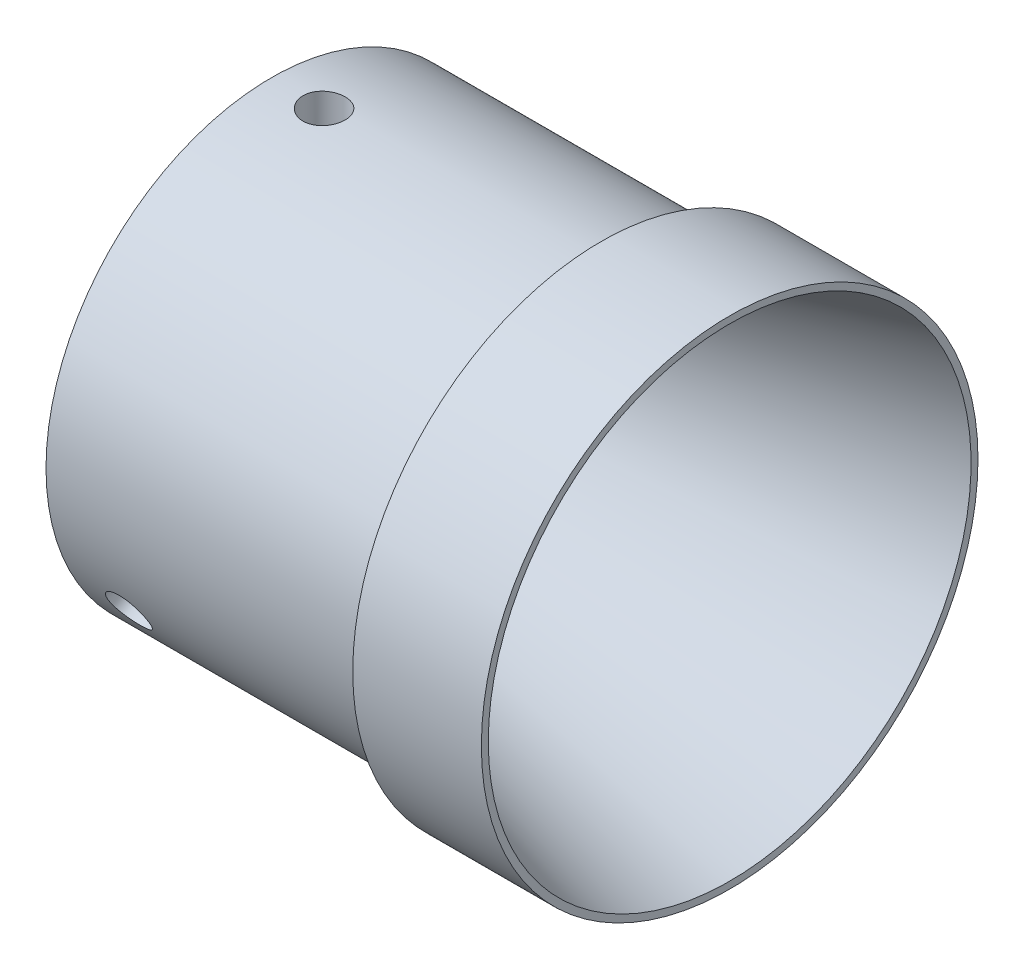
from build123d import *

# Parameters (mm, degrees)
CIRPATTERN1_COUNT = 3


with BuildPart() as part:
    # Sketch1 → Revolve1 (revolve)
    with BuildSketch(Plane.XY, mode=Mode.PRIVATE) as revolve1_sk:
        Polygon((0, 14.478), (21.149404438, 14.478), (21.149404438, 15.9385), (29.404404438, 15.9385), (29.404404438, 15.494), (3.81, 8.636), (3.81, 10.16), (0, 10.16), align=None)
    revolve(revolve1_sk.sketch.rotate(Axis((0, 0, 0), (1, 0, 0)), 90), axis=Axis((0, 0, 0), (1, 0, 0)))

    # Sketch3 → #6-32 Tapped Hole1 (revolve, cut)
    with BuildSketch(Plane(origin=(3.369404438, 14.478, 0), x_dir=(0, 0, 1), z_dir=(1, 0, 0))):
        Polygon((0, 0), (0, 4.445), (1.35255, 3.63230597), (1.35255, 0), align=None)
    f_6_32_tapped_hole1 = revolve(axis=Axis((3.369404438, 20.828, 0), (0, -1, 0)), mode=Mode.SUBTRACT)

    # CirPattern1: #6-32 Tapped Hole1 ×3 about axis
    cirpattern1_axis = Axis((0, 0, 0), (-1, 0, 0))
    for i in range(1, CIRPATTERN1_COUNT):
        add(f_6_32_tapped_hole1.rotate(cirpattern1_axis, i * 360 / CIRPATTERN1_COUNT), mode=Mode.SUBTRACT)


solid = part.part
